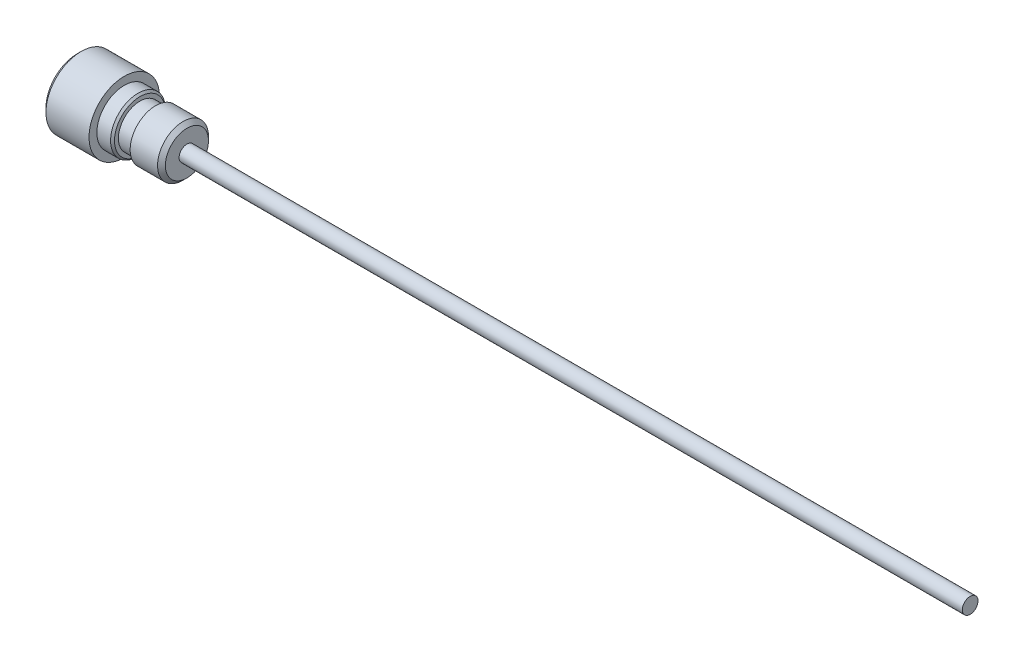
from build123d import *

# Parameters (mm, degrees)
CROQUIS1_R              = 9
SALIENTE_EXTRUIR1_DEPTH = 12
CHAFL_N1_SIZE           = 1
CROQUIS2_R              = 7
SALIENTE_EXTRUIR2_DEPTH = 4
CROQUIS3_R              = 5.5
SALIENTE_EXTRUIR3_DEPTH = 4
CROQUIS4_R              = 6.5
SALIENTE_EXTRUIR4_DEPTH = 8
CHAFL_N2_SIZE           = 1
CROQUIS5_R              = 2
SALIENTE_EXTRUIR5_DEPTH = 200
CHAFL_N3_SIZE           = 0.5


with BuildPart() as part:
    # Croquis1 → Saliente-Extruir1 (new body)
    with BuildSketch(Plane(origin=(0, 0, 0), x_dir=(0, 0, -1), z_dir=(1, 0, 0))):
        Circle(CROQUIS1_R)
    extrude(amount=SALIENTE_EXTRUIR1_DEPTH)

    # Chaflán1
    chafl_n1_edges = [part.edges().sort_by_distance(p)[0] for p in [
        (0, 0, 9),
    ]]
    chamfer(chafl_n1_edges, length=CHAFL_N1_SIZE)

    # Croquis2 → Saliente-Extruir2 (add)
    with BuildSketch(Plane(origin=(12, 0, 0), x_dir=(0, 0, -1), z_dir=(1, 0, 0))):
        Circle(CROQUIS2_R)
    extrude(amount=SALIENTE_EXTRUIR2_DEPTH)

    # Croquis3 → Saliente-Extruir3 (add)
    with BuildSketch(Plane(origin=(16, 0, 0), x_dir=(0, 0, -1), z_dir=(1, 0, 0))):
        Circle(CROQUIS3_R)
    extrude(amount=SALIENTE_EXTRUIR3_DEPTH)

    # Croquis4 → Saliente-Extruir4 (add)
    with BuildSketch(Plane(origin=(20, 0, 0), x_dir=(0, 0, -1), z_dir=(1, 0, 0))):
        Circle(CROQUIS4_R)
    extrude(amount=SALIENTE_EXTRUIR4_DEPTH)

    # Chaflán2
    chafl_n2_edges = [part.edges().sort_by_distance(p)[0] for p in [
        (28, 0, 6.5),
    ]]
    chamfer(chafl_n2_edges, length=CHAFL_N2_SIZE)

    # Croquis5 → Saliente-Extruir5 (add)
    with BuildSketch(Plane(origin=(28, 0, 0), x_dir=(0, 0, -1), z_dir=(1, 0, 0))):
        Circle(CROQUIS5_R)
    extrude(amount=SALIENTE_EXTRUIR5_DEPTH)

    # Chaflán3
    chafl_n3_edges = [part.edges().sort_by_distance(p)[0] for p in [
        (16, 0, 7),
    ]]
    chamfer(chafl_n3_edges, length=CHAFL_N3_SIZE)


solid = part.part
